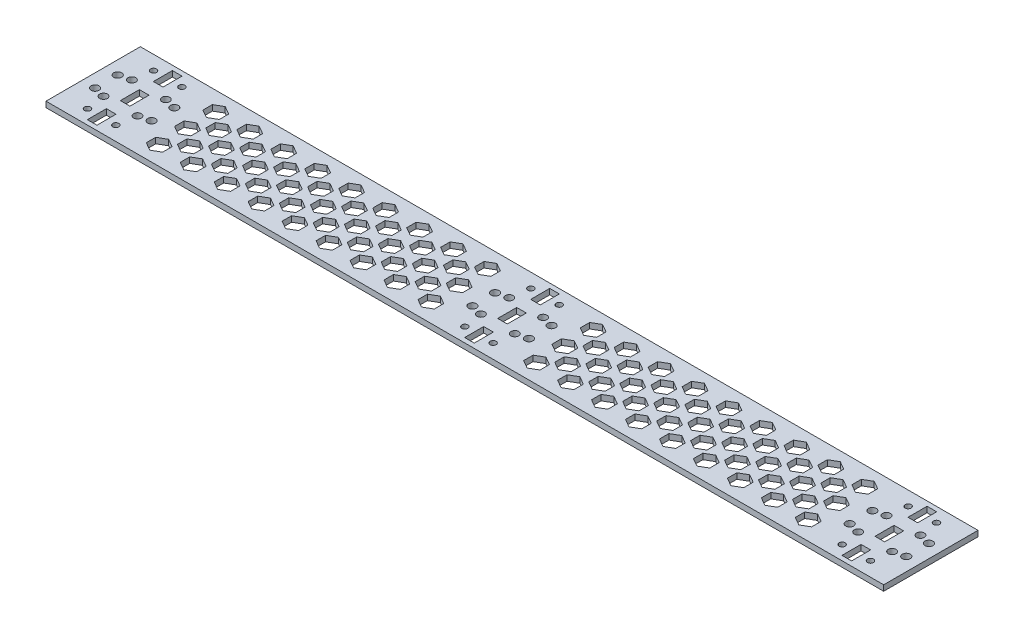
from build123d import *

# Parameters (mm, degrees)
SKETCH_1_W      = 444
SKETCH_1_H      = 50
SKETCH_1_R      = 2.1
SKETCH_1_R_2    = 2.05
SKETCH_1_R_3    = 1.6
SKETCH_1_W_2    = 5.1
SKETCH_1_H_2    = 10.1
EXTRUDE_1_DEPTH = 3


with BuildPart() as part:
    # 草图1 → 凸台-拉伸1 (new body)
    with BuildSketch(Plane(origin=(0, 0, 0), x_dir=(1, 0, 0), z_dir=(0, 1, 0))):
        Rectangle(SKETCH_1_W, SKETCH_1_H)
        with Locations(Location((-15, 6, 0), (0, 0, 270))):
            Circle(SKETCH_1_R, mode=Mode.SUBTRACT)
        with Locations(Location((15, 6, 0), (0, 0, 270))):
            Circle(SKETCH_1_R, mode=Mode.SUBTRACT)
        with Locations(Location((15, -6, 0), (0, 0, 270))):
            Circle(SKETCH_1_R, mode=Mode.SUBTRACT)
        with Locations(Location((-15, -6, 0), (0, 0, 270))):
            Circle(SKETCH_1_R, mode=Mode.SUBTRACT)
        with Locations(Location((-9, 7.5, 0), (0, 0, 270))):
            Circle(SKETCH_1_R_2, mode=Mode.SUBTRACT)
        with Locations(Location((9, 7.5, 0), (0, 0, 270))):
            Circle(SKETCH_1_R_2, mode=Mode.SUBTRACT)
        with Locations(Location((9, -7.5, 0), (0, 0, 270))):
            Circle(SKETCH_1_R_2, mode=Mode.SUBTRACT)
        with Locations(Location((-9, -7.5, 0), (0, 0, 270))):
            Circle(SKETCH_1_R_2, mode=Mode.SUBTRACT)
        with Locations(Location((7.5, -17.5, 0), (0, 0, 270))):
            Circle(SKETCH_1_R_3, mode=Mode.SUBTRACT)
        with Locations(Location((-7.5, -17.5, 0), (0, 0, 270))):
            Circle(SKETCH_1_R_3, mode=Mode.SUBTRACT)
        with Locations(Location((7.5, 17.5, 0), (0, 0, 270))):
            Circle(SKETCH_1_R_3, mode=Mode.SUBTRACT)
        with Locations(Location((-7.5, 17.5, 0), (0, 0, 270))):
            Circle(SKETCH_1_R_3, mode=Mode.SUBTRACT)
        with Locations(Location((185, 6, 0), (0, 0, 270))):
            Circle(SKETCH_1_R, mode=Mode.SUBTRACT)
        with Locations(Location((215, 6, 0), (0, 0, 270))):
            Circle(SKETCH_1_R, mode=Mode.SUBTRACT)
        with Locations(Location((215, -6, 0), (0, 0, 270))):
            Circle(SKETCH_1_R, mode=Mode.SUBTRACT)
        with Locations(Location((185, -6, 0), (0, 0, 270))):
            Circle(SKETCH_1_R, mode=Mode.SUBTRACT)
        with Locations(Location((191, 7.5, 0), (0, 0, 270))):
            Circle(SKETCH_1_R_2, mode=Mode.SUBTRACT)
        with Locations(Location((209, 7.5, 0), (0, 0, 270))):
            Circle(SKETCH_1_R_2, mode=Mode.SUBTRACT)
        with Locations(Location((209, -7.5, 0), (0, 0, 270))):
            Circle(SKETCH_1_R_2, mode=Mode.SUBTRACT)
        with Locations(Location((191, -7.5, 0), (0, 0, 270))):
            Circle(SKETCH_1_R_2, mode=Mode.SUBTRACT)
        with Locations(Location((207.5, -17.5, 0), (0, 0, 270))):
            Circle(SKETCH_1_R_3, mode=Mode.SUBTRACT)
        with Locations(Location((192.5, -17.5, 0), (0, 0, 270))):
            Circle(SKETCH_1_R_3, mode=Mode.SUBTRACT)
        with Locations(Location((207.5, 17.5, 0), (0, 0, 270))):
            Circle(SKETCH_1_R_3, mode=Mode.SUBTRACT)
        with Locations(Location((192.5, 17.5, 0), (0, 0, 270))):
            Circle(SKETCH_1_R_3, mode=Mode.SUBTRACT)
        with Locations(Location((-215, 6, 0), (0, 0, 270))):
            Circle(SKETCH_1_R, mode=Mode.SUBTRACT)
        with Locations(Location((-185, 6, 0), (0, 0, 270))):
            Circle(SKETCH_1_R, mode=Mode.SUBTRACT)
        with Locations(Location((-185, -6, 0), (0, 0, 270))):
            Circle(SKETCH_1_R, mode=Mode.SUBTRACT)
        with Locations(Location((-215, -6, 0), (0, 0, 270))):
            Circle(SKETCH_1_R, mode=Mode.SUBTRACT)
        with Locations(Location((-209, 7.5, 0), (0, 0, 270))):
            Circle(SKETCH_1_R_2, mode=Mode.SUBTRACT)
        with Locations(Location((-191, 7.5, 0), (0, 0, 270))):
            Circle(SKETCH_1_R_2, mode=Mode.SUBTRACT)
        with Locations(Location((-191, -7.5, 0), (0, 0, 270))):
            Circle(SKETCH_1_R_2, mode=Mode.SUBTRACT)
        with Locations(Location((-209, -7.5, 0), (0, 0, 270))):
            Circle(SKETCH_1_R_2, mode=Mode.SUBTRACT)
        with Locations(Location((-192.5, -17.5, 0), (0, 0, 270))):
            Circle(SKETCH_1_R_3, mode=Mode.SUBTRACT)
        with Locations(Location((-207.5, -17.5, 0), (0, 0, 270))):
            Circle(SKETCH_1_R_3, mode=Mode.SUBTRACT)
        with Locations(Location((-192.5, 17.5, 0), (0, 0, 270))):
            Circle(SKETCH_1_R_3, mode=Mode.SUBTRACT)
        with Locations(Location((-207.5, 17.5, 0), (0, 0, 270))):
            Circle(SKETCH_1_R_3, mode=Mode.SUBTRACT)
        with Locations((200, 0)):
            Rectangle(SKETCH_1_W_2, SKETCH_1_H_2, mode=Mode.SUBTRACT)
        Rectangle(SKETCH_1_W_2, SKETCH_1_H_2, mode=Mode.SUBTRACT)
        with Locations((0, 17.5)):
            Rectangle(SKETCH_1_W_2, SKETCH_1_H_2, mode=Mode.SUBTRACT)
        with Locations((0, -17.5)):
            Rectangle(SKETCH_1_W_2, SKETCH_1_H_2, mode=Mode.SUBTRACT)
        with Locations((200, 17.5)):
            Rectangle(SKETCH_1_W_2, SKETCH_1_H_2, mode=Mode.SUBTRACT)
        with Locations((200, -17.5)):
            Rectangle(SKETCH_1_W_2, SKETCH_1_H_2, mode=Mode.SUBTRACT)
        with Locations((-200, 0)):
            Rectangle(SKETCH_1_W_2, SKETCH_1_H_2, mode=Mode.SUBTRACT)
        with Locations((-200, 17.5)):
            Rectangle(SKETCH_1_W_2, SKETCH_1_H_2, mode=Mode.SUBTRACT)
        with Locations((-200, -17.5)):
            Rectangle(SKETCH_1_W_2, SKETCH_1_H_2, mode=Mode.SUBTRACT)
        Polygon((-55, 12.5), (-59.330127019, 10), (-59.330127019, 5), (-55, 2.5), (-50.669872981, 5), (-50.669872981, 10), align=None, mode=Mode.SUBTRACT)
        Polygon((-28, 5), (-32.330127019, 2.5), (-32.330127019, -2.5), (-28, -5), (-23.669872981, -2.5), (-23.669872981, 2.5), align=None, mode=Mode.SUBTRACT)
        Polygon((-28, 20), (-32.330127019, 17.5), (-32.330127019, 12.5), (-28, 10), (-23.669872981, 12.5), (-23.669872981, 17.5), align=None, mode=Mode.SUBTRACT)
        Polygon((-28, -20), (-23.669872981, -17.5), (-23.669872981, -12.5), (-28, -10), (-32.330127019, -12.5), (-32.330127019, -17.5), align=None, mode=Mode.SUBTRACT)
        Polygon((-37, 12.5), (-41.330127019, 10), (-41.330127019, 5), (-37, 2.5), (-32.669872981, 5), (-32.669872981, 10), align=None, mode=Mode.SUBTRACT)
        Polygon((-37, -12.5), (-32.669872981, -10), (-32.669872981, -5), (-37, -2.5), (-41.330127019, -5), (-41.330127019, -10), align=None, mode=Mode.SUBTRACT)
        Polygon((-46, 20), (-50.330127019, 17.5), (-50.330127019, 12.5), (-46, 10), (-41.669872981, 12.5), (-41.669872981, 17.5), align=None, mode=Mode.SUBTRACT)
        Polygon((-46, -20), (-41.669872981, -17.5), (-41.669872981, -12.5), (-46, -10), (-50.330127019, -12.5), (-50.330127019, -17.5), align=None, mode=Mode.SUBTRACT)
        Polygon((-55, -12.5), (-50.669872981, -10), (-50.669872981, -5), (-55, -2.5), (-59.330127019, -5), (-59.330127019, -10), align=None, mode=Mode.SUBTRACT)
        Polygon((-46, 5), (-50.330127019, 2.5), (-50.330127019, -2.5), (-46, -5), (-41.669872981, -2.5), (-41.669872981, 2.5), align=None, mode=Mode.SUBTRACT)
        Polygon((-73, 12.5), (-77.330127019, 10), (-77.330127019, 5), (-73, 2.5), (-68.669872981, 5), (-68.669872981, 10), align=None, mode=Mode.SUBTRACT)
        Polygon((-64, 20), (-68.330127019, 17.5), (-68.330127019, 12.5), (-64, 10), (-59.669872981, 12.5), (-59.669872981, 17.5), align=None, mode=Mode.SUBTRACT)
        Polygon((-64, -20), (-59.669872981, -17.5), (-59.669872981, -12.5), (-64, -10), (-68.330127019, -12.5), (-68.330127019, -17.5), align=None, mode=Mode.SUBTRACT)
        Polygon((-73, -12.5), (-68.669872981, -10), (-68.669872981, -5), (-73, -2.5), (-77.330127019, -5), (-77.330127019, -10), align=None, mode=Mode.SUBTRACT)
        Polygon((-64, 5), (-68.330127019, 2.5), (-68.330127019, -2.5), (-64, -5), (-59.669872981, -2.5), (-59.669872981, 2.5), align=None, mode=Mode.SUBTRACT)
        Polygon((-91, 12.5), (-95.330127019, 10), (-95.330127019, 5), (-91, 2.5), (-86.669872981, 5), (-86.669872981, 10), align=None, mode=Mode.SUBTRACT)
        Polygon((-82, 20), (-86.330127019, 17.5), (-86.330127019, 12.5), (-82, 10), (-77.669872981, 12.5), (-77.669872981, 17.5), align=None, mode=Mode.SUBTRACT)
        Polygon((-82, -20), (-77.669872981, -17.5), (-77.669872981, -12.5), (-82, -10), (-86.330127019, -12.5), (-86.330127019, -17.5), align=None, mode=Mode.SUBTRACT)
        Polygon((-91, -12.5), (-86.669872981, -10), (-86.669872981, -5), (-91, -2.5), (-95.330127019, -5), (-95.330127019, -10), align=None, mode=Mode.SUBTRACT)
        Polygon((-82, 5), (-86.330127019, 2.5), (-86.330127019, -2.5), (-82, -5), (-77.669872981, -2.5), (-77.669872981, 2.5), align=None, mode=Mode.SUBTRACT)
        Polygon((-109, 12.5), (-113.330127019, 10), (-113.330127019, 5), (-109, 2.5), (-104.669872981, 5), (-104.669872981, 10), align=None, mode=Mode.SUBTRACT)
        Polygon((-100, 20), (-104.330127019, 17.5), (-104.330127019, 12.5), (-100, 10), (-95.669872981, 12.5), (-95.669872981, 17.5), align=None, mode=Mode.SUBTRACT)
        Polygon((-100, -20), (-95.669872981, -17.5), (-95.669872981, -12.5), (-100, -10), (-104.330127019, -12.5), (-104.330127019, -17.5), align=None, mode=Mode.SUBTRACT)
        Polygon((-109, -12.5), (-104.669872981, -10), (-104.669872981, -5), (-109, -2.5), (-113.330127019, -5), (-113.330127019, -10), align=None, mode=Mode.SUBTRACT)
        Polygon((-100, 5), (-104.330127019, 2.5), (-104.330127019, -2.5), (-100, -5), (-95.669872981, -2.5), (-95.669872981, 2.5), align=None, mode=Mode.SUBTRACT)
        Polygon((-127, 12.5), (-131.330127019, 10), (-131.330127019, 5), (-127, 2.5), (-122.669872981, 5), (-122.669872981, 10), align=None, mode=Mode.SUBTRACT)
        Polygon((-118, 20), (-122.330127019, 17.5), (-122.330127019, 12.5), (-118, 10), (-113.669872981, 12.5), (-113.669872981, 17.5), align=None, mode=Mode.SUBTRACT)
        Polygon((-118, -20), (-113.669872981, -17.5), (-113.669872981, -12.5), (-118, -10), (-122.330127019, -12.5), (-122.330127019, -17.5), align=None, mode=Mode.SUBTRACT)
        Polygon((-127, -12.5), (-122.669872981, -10), (-122.669872981, -5), (-127, -2.5), (-131.330127019, -5), (-131.330127019, -10), align=None, mode=Mode.SUBTRACT)
        Polygon((-118, 5), (-122.330127019, 2.5), (-122.330127019, -2.5), (-118, -5), (-113.669872981, -2.5), (-113.669872981, 2.5), align=None, mode=Mode.SUBTRACT)
        Polygon((-145, 12.5), (-149.330127019, 10), (-149.330127019, 5), (-145, 2.5), (-140.669872981, 5), (-140.669872981, 10), align=None, mode=Mode.SUBTRACT)
        Polygon((-136, 20), (-140.330127019, 17.5), (-140.330127019, 12.5), (-136, 10), (-131.669872981, 12.5), (-131.669872981, 17.5), align=None, mode=Mode.SUBTRACT)
        Polygon((-136, -20), (-131.669872981, -17.5), (-131.669872981, -12.5), (-136, -10), (-140.330127019, -12.5), (-140.330127019, -17.5), align=None, mode=Mode.SUBTRACT)
        Polygon((-145, -12.5), (-140.669872981, -10), (-140.669872981, -5), (-145, -2.5), (-149.330127019, -5), (-149.330127019, -10), align=None, mode=Mode.SUBTRACT)
        Polygon((-136, 5), (-140.330127019, 2.5), (-140.330127019, -2.5), (-136, -5), (-131.669872981, -2.5), (-131.669872981, 2.5), align=None, mode=Mode.SUBTRACT)
        Polygon((-163, 12.5), (-167.330127019, 10), (-167.330127019, 5), (-163, 2.5), (-158.669872981, 5), (-158.669872981, 10), align=None, mode=Mode.SUBTRACT)
        Polygon((-154, 20), (-158.330127019, 17.5), (-158.330127019, 12.5), (-154, 10), (-149.669872981, 12.5), (-149.669872981, 17.5), align=None, mode=Mode.SUBTRACT)
        Polygon((-154, -20), (-149.669872981, -17.5), (-149.669872981, -12.5), (-154, -10), (-158.330127019, -12.5), (-158.330127019, -17.5), align=None, mode=Mode.SUBTRACT)
        Polygon((-163, -12.5), (-158.669872981, -10), (-158.669872981, -5), (-163, -2.5), (-167.330127019, -5), (-167.330127019, -10), align=None, mode=Mode.SUBTRACT)
        Polygon((-154, 5), (-158.330127019, 2.5), (-158.330127019, -2.5), (-154, -5), (-149.669872981, -2.5), (-149.669872981, 2.5), align=None, mode=Mode.SUBTRACT)
        Polygon((-172, 20), (-176.330127019, 17.5), (-176.330127019, 12.5), (-172, 10), (-167.669872981, 12.5), (-167.669872981, 17.5), align=None, mode=Mode.SUBTRACT)
        Polygon((-172, 5), (-176.330127019, 2.5), (-176.330127019, -2.5), (-172, -5), (-167.669872981, -2.5), (-167.669872981, 2.5), align=None, mode=Mode.SUBTRACT)
        Polygon((-172, -20), (-167.669872981, -17.5), (-167.669872981, -12.5), (-172, -10), (-176.330127019, -12.5), (-176.330127019, -17.5), align=None, mode=Mode.SUBTRACT)
        Polygon((23.669872981, 17.5), (28, 20), (32.330127019, 17.5), (32.330127019, 12.5), (28, 10), (23.669872981, 12.5), align=None, mode=Mode.SUBTRACT)
        Polygon((23.669872981, 2.5), (28, 5), (32.330127019, 2.5), (32.330127019, -2.5), (28, -5), (23.669872981, -2.5), align=None, mode=Mode.SUBTRACT)
        Polygon((32.330127019, -17.5), (28, -20), (23.669872981, -17.5), (23.669872981, -12.5), (28, -10), (32.330127019, -12.5), align=None, mode=Mode.SUBTRACT)
        Polygon((32.669872981, 10), (37, 12.5), (41.330127019, 10), (41.330127019, 5), (37, 2.5), (32.669872981, 5), align=None, mode=Mode.SUBTRACT)
        Polygon((41.330127019, -10), (37, -12.5), (32.669872981, -10), (32.669872981, -5), (37, -2.5), (41.330127019, -5), align=None, mode=Mode.SUBTRACT)
        Polygon((50.330127019, -17.5), (46, -20), (41.669872981, -17.5), (41.669872981, -12.5), (46, -10), (50.330127019, -12.5), align=None, mode=Mode.SUBTRACT)
        Polygon((41.669872981, 2.5), (46, 5), (50.330127019, 2.5), (50.330127019, -2.5), (46, -5), (41.669872981, -2.5), align=None, mode=Mode.SUBTRACT)
        Polygon((41.669872981, 17.5), (46, 20), (50.330127019, 17.5), (50.330127019, 12.5), (46, 10), (41.669872981, 12.5), align=None, mode=Mode.SUBTRACT)
        Polygon((50.669872981, 10), (55, 12.5), (59.330127019, 10), (59.330127019, 5), (55, 2.5), (50.669872981, 5), align=None, mode=Mode.SUBTRACT)
        Polygon((59.330127019, -10), (55, -12.5), (50.669872981, -10), (50.669872981, -5), (55, -2.5), (59.330127019, -5), align=None, mode=Mode.SUBTRACT)
        Polygon((68.330127019, -17.5), (64, -20), (59.669872981, -17.5), (59.669872981, -12.5), (64, -10), (68.330127019, -12.5), align=None, mode=Mode.SUBTRACT)
        Polygon((59.669872981, 2.5), (64, 5), (68.330127019, 2.5), (68.330127019, -2.5), (64, -5), (59.669872981, -2.5), align=None, mode=Mode.SUBTRACT)
        Polygon((59.669872981, 17.5), (64, 20), (68.330127019, 17.5), (68.330127019, 12.5), (64, 10), (59.669872981, 12.5), align=None, mode=Mode.SUBTRACT)
        Polygon((68.669872981, 10), (73, 12.5), (77.330127019, 10), (77.330127019, 5), (73, 2.5), (68.669872981, 5), align=None, mode=Mode.SUBTRACT)
        Polygon((77.330127019, -10), (73, -12.5), (68.669872981, -10), (68.669872981, -5), (73, -2.5), (77.330127019, -5), align=None, mode=Mode.SUBTRACT)
        Polygon((86.330127019, -17.5), (82, -20), (77.669872981, -17.5), (77.669872981, -12.5), (82, -10), (86.330127019, -12.5), align=None, mode=Mode.SUBTRACT)
        Polygon((77.669872981, 17.5), (82, 20), (86.330127019, 17.5), (86.330127019, 12.5), (82, 10), (77.669872981, 12.5), align=None, mode=Mode.SUBTRACT)
        Polygon((86.669872981, 10), (91, 12.5), (95.330127019, 10), (95.330127019, 5), (91, 2.5), (86.669872981, 5), align=None, mode=Mode.SUBTRACT)
        Polygon((77.669872981, 2.5), (82, 5), (86.330127019, 2.5), (86.330127019, -2.5), (82, -5), (77.669872981, -2.5), align=None, mode=Mode.SUBTRACT)
        Polygon((95.330127019, -10), (91, -12.5), (86.669872981, -10), (86.669872981, -5), (91, -2.5), (95.330127019, -5), align=None, mode=Mode.SUBTRACT)
        Polygon((104.330127019, -17.5), (100, -20), (95.669872981, -17.5), (95.669872981, -12.5), (100, -10), (104.330127019, -12.5), align=None, mode=Mode.SUBTRACT)
        Polygon((95.669872981, 2.5), (100, 5), (104.330127019, 2.5), (104.330127019, -2.5), (100, -5), (95.669872981, -2.5), align=None, mode=Mode.SUBTRACT)
        Polygon((95.669872981, 17.5), (100, 20), (104.330127019, 17.5), (104.330127019, 12.5), (100, 10), (95.669872981, 12.5), align=None, mode=Mode.SUBTRACT)
        Polygon((113.330127019, -10), (109, -12.5), (104.669872981, -10), (104.669872981, -5), (109, -2.5), (113.330127019, -5), align=None, mode=Mode.SUBTRACT)
        Polygon((104.669872981, 10), (109, 12.5), (113.330127019, 10), (113.330127019, 5), (109, 2.5), (104.669872981, 5), align=None, mode=Mode.SUBTRACT)
        Polygon((122.330127019, -17.5), (118, -20), (113.669872981, -17.5), (113.669872981, -12.5), (118, -10), (122.330127019, -12.5), align=None, mode=Mode.SUBTRACT)
        Polygon((113.669872981, 2.5), (118, 5), (122.330127019, 2.5), (122.330127019, -2.5), (118, -5), (113.669872981, -2.5), align=None, mode=Mode.SUBTRACT)
        Polygon((113.669872981, 17.5), (118, 20), (122.330127019, 17.5), (122.330127019, 12.5), (118, 10), (113.669872981, 12.5), align=None, mode=Mode.SUBTRACT)
        Polygon((122.669872981, 10), (127, 12.5), (131.330127019, 10), (131.330127019, 5), (127, 2.5), (122.669872981, 5), align=None, mode=Mode.SUBTRACT)
        Polygon((131.330127019, -10), (127, -12.5), (122.669872981, -10), (122.669872981, -5), (127, -2.5), (131.330127019, -5), align=None, mode=Mode.SUBTRACT)
        Polygon((140.330127019, -17.5), (136, -20), (131.669872981, -17.5), (131.669872981, -12.5), (136, -10), (140.330127019, -12.5), align=None, mode=Mode.SUBTRACT)
        Polygon((131.669872981, 2.5), (136, 5), (140.330127019, 2.5), (140.330127019, -2.5), (136, -5), (131.669872981, -2.5), align=None, mode=Mode.SUBTRACT)
        Polygon((131.669872981, 17.5), (136, 20), (140.330127019, 17.5), (140.330127019, 12.5), (136, 10), (131.669872981, 12.5), align=None, mode=Mode.SUBTRACT)
        Polygon((140.669872981, 10), (145, 12.5), (149.330127019, 10), (149.330127019, 5), (145, 2.5), (140.669872981, 5), align=None, mode=Mode.SUBTRACT)
        Polygon((149.330127019, -10), (145, -12.5), (140.669872981, -10), (140.669872981, -5), (145, -2.5), (149.330127019, -5), align=None, mode=Mode.SUBTRACT)
        Polygon((158.330127019, -17.5), (154, -20), (149.669872981, -17.5), (149.669872981, -12.5), (154, -10), (158.330127019, -12.5), align=None, mode=Mode.SUBTRACT)
        Polygon((149.669872981, 2.5), (154, 5), (158.330127019, 2.5), (158.330127019, -2.5), (154, -5), (149.669872981, -2.5), align=None, mode=Mode.SUBTRACT)
        Polygon((149.669872981, 17.5), (154, 20), (158.330127019, 17.5), (158.330127019, 12.5), (154, 10), (149.669872981, 12.5), align=None, mode=Mode.SUBTRACT)
        Polygon((158.669872981, 10), (163, 12.5), (167.330127019, 10), (167.330127019, 5), (163, 2.5), (158.669872981, 5), align=None, mode=Mode.SUBTRACT)
        Polygon((167.330127019, -10), (163, -12.5), (158.669872981, -10), (158.669872981, -5), (163, -2.5), (167.330127019, -5), align=None, mode=Mode.SUBTRACT)
        Polygon((176.330127019, -17.5), (172, -20), (167.669872981, -17.5), (167.669872981, -12.5), (172, -10), (176.330127019, -12.5), align=None, mode=Mode.SUBTRACT)
        Polygon((167.669872981, 2.5), (172, 5), (176.330127019, 2.5), (176.330127019, -2.5), (172, -5), (167.669872981, -2.5), align=None, mode=Mode.SUBTRACT)
        Polygon((167.669872981, 17.5), (172, 20), (176.330127019, 17.5), (176.330127019, 12.5), (172, 10), (167.669872981, 12.5), align=None, mode=Mode.SUBTRACT)
    extrude(amount=EXTRUDE_1_DEPTH)


solid = part.part
